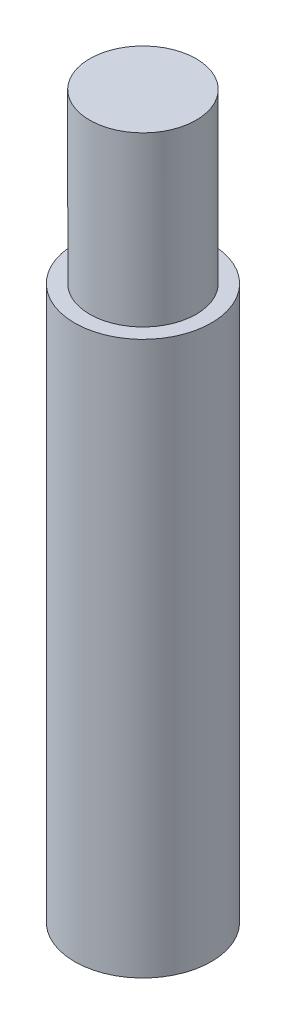
from build123d import *

# Parameters (mm, degrees)
CROQUIS2_R              = 12.2
SALIENTE_EXTRUIR1_DEPTH = 98.7
CROQUIS3_R              = 9.5
SALIENTE_EXTRUIR2_DEPTH = 30


with BuildPart() as part:
    # Croquis2 → Saliente-Extruir1 (new body)
    with BuildSketch(Plane(origin=(0, 0, 0), x_dir=(1, 0, 0), z_dir=(0, 1, 0))):
        with Locations(Location((0, 0, 0), (0, 0, 270))):
            Circle(CROQUIS2_R)
    extrude(amount=SALIENTE_EXTRUIR1_DEPTH)

    # Croquis3 → Saliente-Extruir2 (add)
    with BuildSketch(Plane(origin=(0, 98.7, 0), x_dir=(1, 0, 0), z_dir=(0, 1, 0))):
        with Locations(Location((0, 0, 0), (0, 0, 90))):
            Circle(CROQUIS3_R)
    extrude(amount=SALIENTE_EXTRUIR2_DEPTH)


solid = part.part
